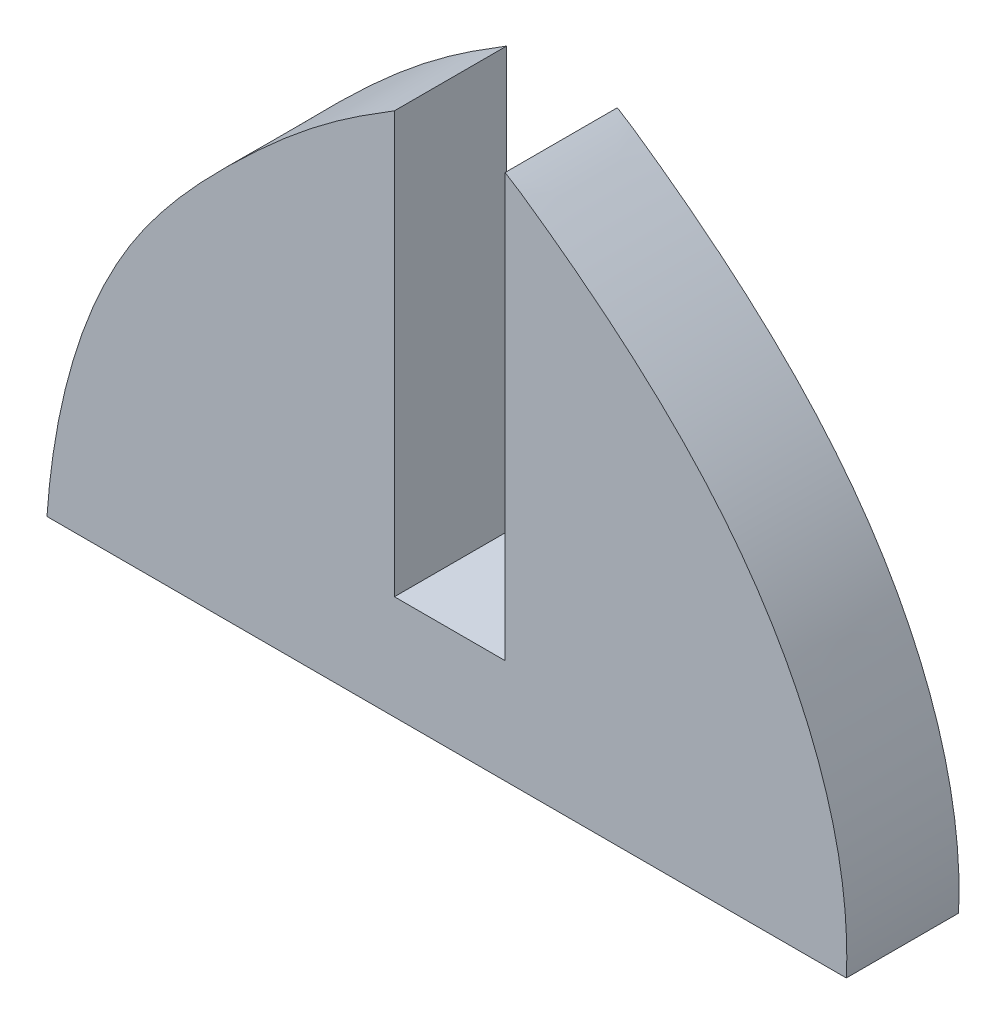
from build123d import *

# Parameters (mm, degrees)
EXTRUDE_1_DEPTH = 8


with BuildPart() as part:
    # 草图1 → 凸台-拉伸1 (new body)
    with BuildSketch(Plane.XY):
        with BuildLine():
            Line((1205.000343889, 200.380448257), (1205.000343889, 170.380448257))
            Line((1205.000343889, 170.380448257), (1212.88866118, 170.380448257))
            Line((1212.88866118, 170.380448257), (1212.88866118, 200.514821588))
            add(Edge.make_bspline(
                [(1212.88866118, 200.514821588), (1213.591796404, 200.102674546), (1216.322248426, 198.206599205), (1221.914919676, 193.964391888), (1232.595967144, 183.625439508), (1237.637966356, 171.491478384), (1237.211883134, 162.95060423)],
                knots=[0.038390069, 0.038390069, 0.038390069, 0.038390069, 0.088763706, 0.237953219, 0.477618195, 1, 1, 1, 1], degree=3))
            Line((1237.211883134, 162.95060423), (1180.232585387, 162.95060423))
            add(Edge.make_bspline(
                [(1205.000343889, 200.380448257), (1203.802132525, 199.644141671), (1199.659392578, 197.029571139), (1193.276793905, 191.438907576), (1183.524062882, 180.866285612), (1180.694379897, 169.80625417), (1180.232585387, 162.95060423)],
                knots=[0.038951436, 0.038951436, 0.038951436, 0.038951436, 0.125740292, 0.329523156, 0.570718558, 1, 1, 1, 1], degree=3))
        make_face()
    extrude(amount=EXTRUDE_1_DEPTH)


solid = part.part
